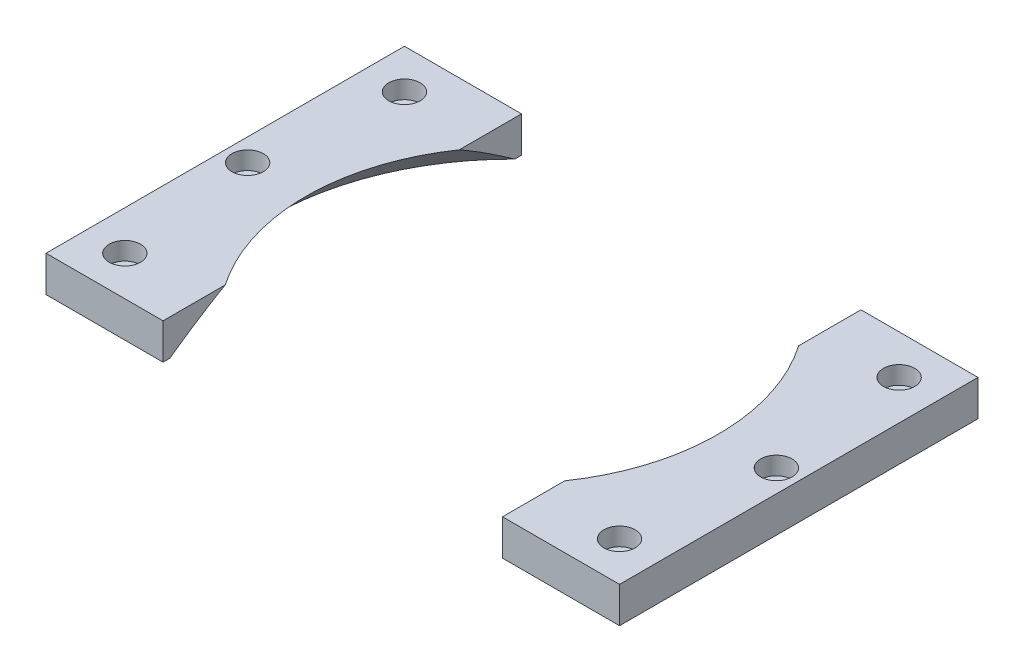
from build123d import *

# Parameters (mm, degrees)
BOSS_EXTRUDE1_DEPTH                           = 12.7
BOSS_EXTRUDE1_2_DEPTH                         = 12.7
DRAFT1_ANGLE                                  = 45
DRAFT2_ANGLE                                  = 45
SKETCH2_W                                     = 120.258567884
SKETCH2_H                                     = 127
CUT_EXTRUDE1_DEPTH                            = 121.482778852
CBORE_FOR_1_4_SOCKET_HEAD_CAP_SCREW1_AT_COUNT = 2
CBORE_FOR_1_4_SOCKET_HEAD_CAP_SCREW1_AT_PITCH = 49.896011426
CBORE_FOR_1_4_SOCKET_HEAD_CAP_SCREW1_2_COUNT  = 2
CBORE_FOR_1_4_SOCKET_HEAD_CAP_SCREW1_2_PITCH  = 99.06
CBORE_FOR_1_4_SOCKET_HEAD_CAP_SCREW1_3_COUNT  = 2
CBORE_FOR_1_4_SOCKET_HEAD_CAP_SCREW1_3_PITCH  = 201.31803496
CBORE_FOR_1_4_SOCKET_HEAD_CAP_SCREW1_4_COUNT  = 2
CBORE_FOR_1_4_SOCKET_HEAD_CAP_SCREW1_4_PITCH  = 187.936668738
CBORE_FOR_1_4_SOCKET_HEAD_CAP_SCREW1_5_COUNT  = 2
CBORE_FOR_1_4_SOCKET_HEAD_CAP_SCREW1_5_PITCH  = 175.26


with BuildPart() as part:
    # Sketch1 → Boss-Extrude1 (new body)
    with BuildSketch(Plane(origin=(0, 0, 0), x_dir=(1, 0, 0), z_dir=(0, 1, 0))):
        with BuildLine():
            Line((-101.6, -63.5), (-101.6, 63.5))
            Line((-101.6, 63.5), (-57.589283942, 63.5))
            ThreePointArc((-57.589283942, 63.5), (-85.725, 0), (-57.589283942, -63.5))
            Line((-57.589283942, -63.5), (-101.6, -63.5))
        make_face()
    extrude(amount=BOSS_EXTRUDE1_DEPTH)

    # Draft2
    draft2_faces = [part.faces().sort_by_distance(p)[0] for p in [
        (-85.725, 6.35, 0),
    ]]
    draft(draft2_faces, Plane(origin=(0, 0, 0), x_dir=(0, 0, -1), z_dir=(0, -1, 0)), DRAFT2_ANGLE)


with BuildPart() as body_2:
    # Sketch1 → Boss-Extrude1 2 (new body)
    with BuildSketch(Plane(origin=(0, 0, 0), x_dir=(1, 0, 0), z_dir=(0, 1, 0))):
        with BuildLine():
            Line((101.6, -63.5), (101.6, 63.5))
            Line((101.6, 63.5), (57.589283942, 63.5))
            ThreePointArc((57.589283942, 63.5), (85.725, 0), (57.589283942, -63.5))
            Line((57.589283942, -63.5), (101.6, -63.5))
        make_face()
    extrude(amount=BOSS_EXTRUDE1_2_DEPTH)

    # Draft1
    draft1_faces = [body_2.faces().sort_by_distance(p)[0] for p in [
        (85.725, 6.35, 0),
    ]]
    draft(draft1_faces, Plane(origin=(0, 0, 0), x_dir=(0, 0, -1), z_dir=(0, -1, 0)), DRAFT1_ANGLE)


with BuildPart() as cut_extrude1_tool:
    # Sketch2 → Cut-Extrude1 (new, through all)
    with BuildSketch(Plane.XZ):
        Rectangle(SKETCH2_W, SKETCH2_H)
    extrude(amount=-CUT_EXTRUDE1_DEPTH)


with BuildPart() as part_1:
    add(part.part)

    # Cut-Extrude1: cut by cut_extrude1_tool
    add(cut_extrude1_tool.part, mode=Mode.SUBTRACT)


with BuildPart() as body_2_1:
    add(body_2.part)

    # Cut-Extrude1: cut by cut_extrude1_tool
    add(cut_extrude1_tool.part, mode=Mode.SUBTRACT)

    # Sketch4 → CBORE for 1/4 Socket Head Cap Screw1 (revolve, cut)
    with BuildSketch(Plane(origin=(87.63, 12.7, 49.53), x_dir=(0, 0, 1), z_dir=(1, 0, 0))):
        Polygon((0, 0), (0, 12.7), (3.3782, 12.7), (3.3782, 6.35), (5.55625, 6.35), (5.55625, 0), align=None)
    cbore_for_1_4_socket_head_cap_screw1 = revolve(axis=Axis((87.63, 19.05, 49.53), (0, -1, 0)), mode=Mode.SUBTRACT)

    # CBORE for 1/4 Socket Head Cap Screw1 at: CBORE for 1/4 Socket Head Cap Screw1 ×2
    with Locations(*[Vector(0.12090144738151404, 0, -0.9926645153429506) * (i * CBORE_FOR_1_4_SOCKET_HEAD_CAP_SCREW1_AT_PITCH) for i in range(1, CBORE_FOR_1_4_SOCKET_HEAD_CAP_SCREW1_AT_COUNT)]):
        add(cbore_for_1_4_socket_head_cap_screw1, mode=Mode.SUBTRACT)

    # CBORE for 1_4 Socket Head Cap Screw1 2: CBORE for 1/4 Socket Head Cap Screw1 ×2
    with Locations(*[(0, 0, -i * CBORE_FOR_1_4_SOCKET_HEAD_CAP_SCREW1_2_PITCH) for i in range(1, CBORE_FOR_1_4_SOCKET_HEAD_CAP_SCREW1_2_COUNT)]):
        add(cbore_for_1_4_socket_head_cap_screw1, mode=Mode.SUBTRACT)


with BuildPart() as part_2:
    add(part_1.part)

    # CBORE for 1_4 Socket Head Cap Screw1 3: CBORE for 1/4 Socket Head Cap Screw1 ×2
    with Locations(*[Vector(-0.8705628387201342, 0, -0.492057256667902) * (i * CBORE_FOR_1_4_SOCKET_HEAD_CAP_SCREW1_3_PITCH) for i in range(1, CBORE_FOR_1_4_SOCKET_HEAD_CAP_SCREW1_3_COUNT)]):
        add(cbore_for_1_4_socket_head_cap_screw1, mode=Mode.SUBTRACT)

    # CBORE for 1_4 Socket Head Cap Screw1 4: CBORE for 1/4 Socket Head Cap Screw1 ×2
    with Locations(*[Vector(-0.9646467675393356, 0, -0.2635462272086457) * (i * CBORE_FOR_1_4_SOCKET_HEAD_CAP_SCREW1_4_PITCH) for i in range(1, CBORE_FOR_1_4_SOCKET_HEAD_CAP_SCREW1_4_COUNT)]):
        add(cbore_for_1_4_socket_head_cap_screw1, mode=Mode.SUBTRACT)

    # CBORE for 1_4 Socket Head Cap Screw1 5: CBORE for 1/4 Socket Head Cap Screw1 ×2
    with Locations(*[(-i * CBORE_FOR_1_4_SOCKET_HEAD_CAP_SCREW1_5_PITCH, 0, 0) for i in range(1, CBORE_FOR_1_4_SOCKET_HEAD_CAP_SCREW1_5_COUNT)]):
        add(cbore_for_1_4_socket_head_cap_screw1, mode=Mode.SUBTRACT)


solid = Compound([body_2_1.part, part_2.part])
